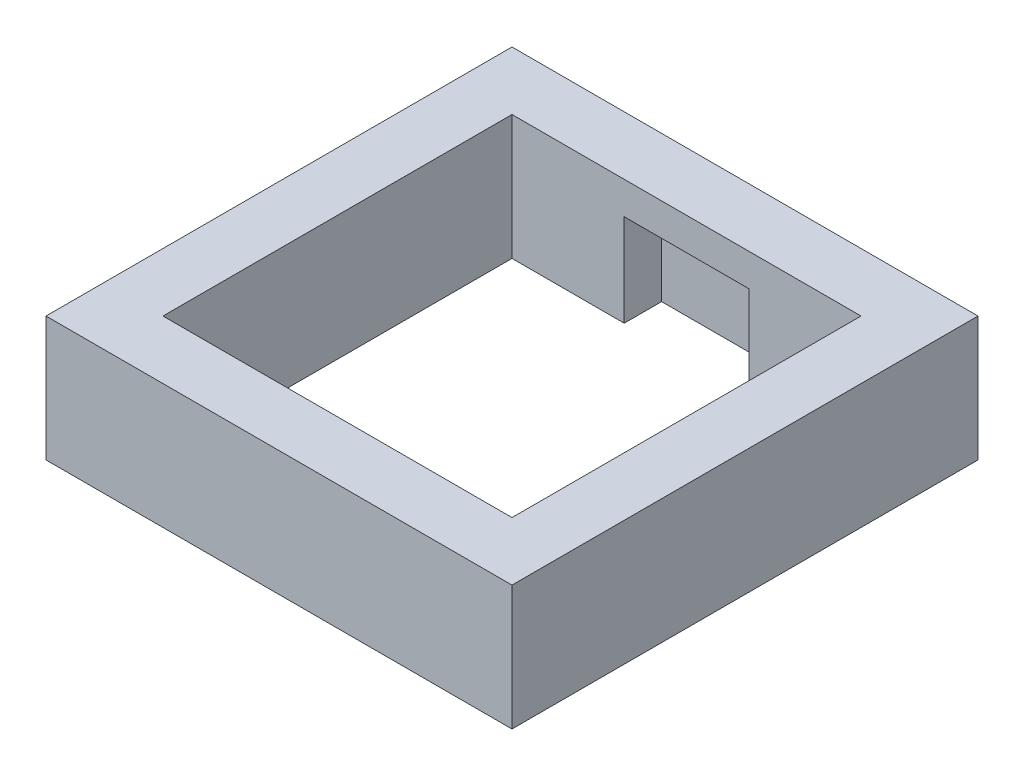
from build123d import *

# Parameters (mm, degrees)
BOSS_EXTRUDE2_DEPTH = 5
CUT_EXTRUDE1_DEPTH  = 3.7


with BuildPart() as part:
    # Sketch2 → Boss-Extrude2 (new body)
    with BuildSketch(Plane(origin=(0, 0, 0), x_dir=(1, 0, 0), z_dir=(0, 1, 0))):
        Polygon((-7, -7), (-7, 7), (-9.345690752, 9.345690752), (-9.345690752, -9.345690752), align=None)
        Polygon((-7, 7), (-2.5, 7), (-2.5, 8.5), (2.5, 8.5), (2.5, 7), (7, 7), (9.345690752, 9.345690752), (-9.345690752, 9.345690752), align=None)
        Polygon((-2.5, 7), (0, 7), (2.5, 7), (2.5, 8.5), (-2.5, 8.5), align=None)
        Polygon((9.345690752, -9.345690752), (9.345690752, 9.345690752), (7, 7), (7, -7), align=None)
        Polygon((7, -7), (2.5, -7), (2.5, -8.5), (-2.5, -8.5), (-2.5, -7), (-7, -7), (-9.345690752, -9.345690752), (9.345690752, -9.345690752), align=None)
        Polygon((2.5, -7), (0, -7), (-2.5, -7), (-2.5, -8.5), (2.5, -8.5), align=None)
    extrude(amount=BOSS_EXTRUDE2_DEPTH)

    # Sketch3 → Cut-Extrude1 (cut)
    with BuildSketch(Plane.XZ):
        Polygon((2.5, -7), (0, -7), (-2.5, -7), (-2.5, -8.5), (2.5, -8.5), align=None)
        Polygon((-2.5, 7), (0, 7), (2.5, 7), (2.5, 8.5), (-2.5, 8.5), align=None)
    extrude(amount=-CUT_EXTRUDE1_DEPTH, mode=Mode.SUBTRACT)


solid = part.part
